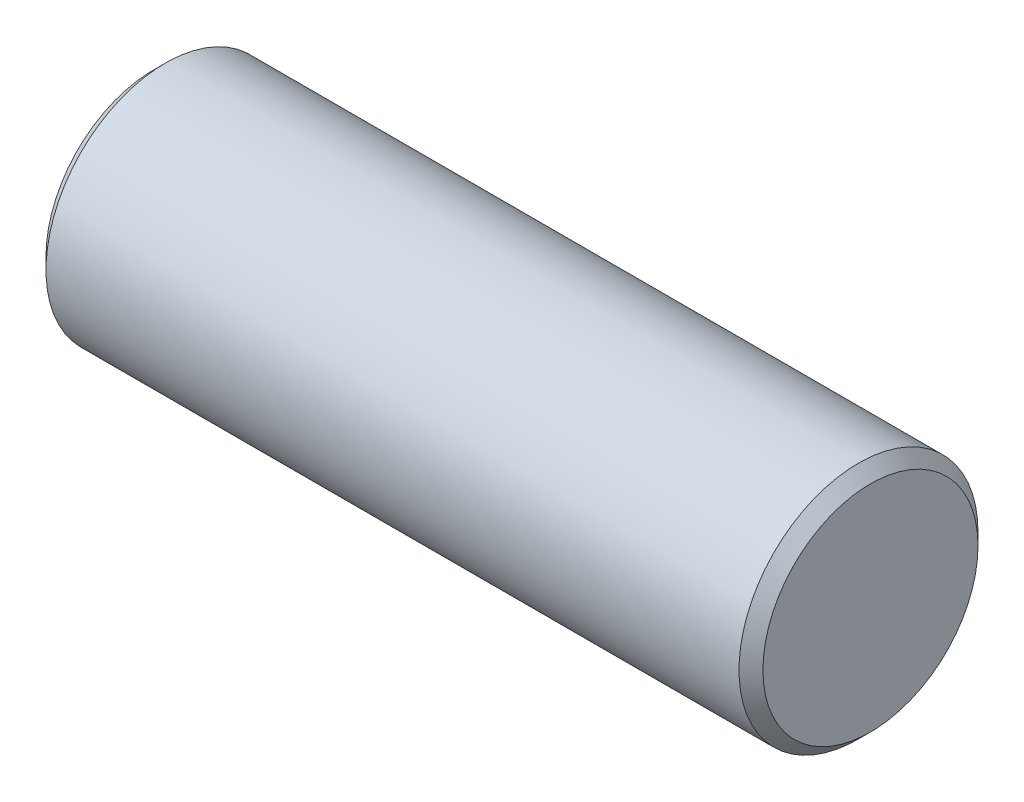
from build123d import *


with BuildPart() as part:
    # 草图1 → 旋转1 (revolve)
    with BuildSketch(Plane.XY, mode=Mode.PRIVATE) as revolve_1_sk:
        Polygon((0, 0), (0, 0.5), (0, 0.9), (0.1, 1), (5.9, 1), (6, 0.9), (6, 0.5), (6, 0), align=None)
    revolve(revolve_1_sk.sketch.rotate(Axis((6, 0, 0), (-1, 0, 0)), 90), axis=Axis((6, 0, 0), (-1, 0, 0)))


solid = part.part
